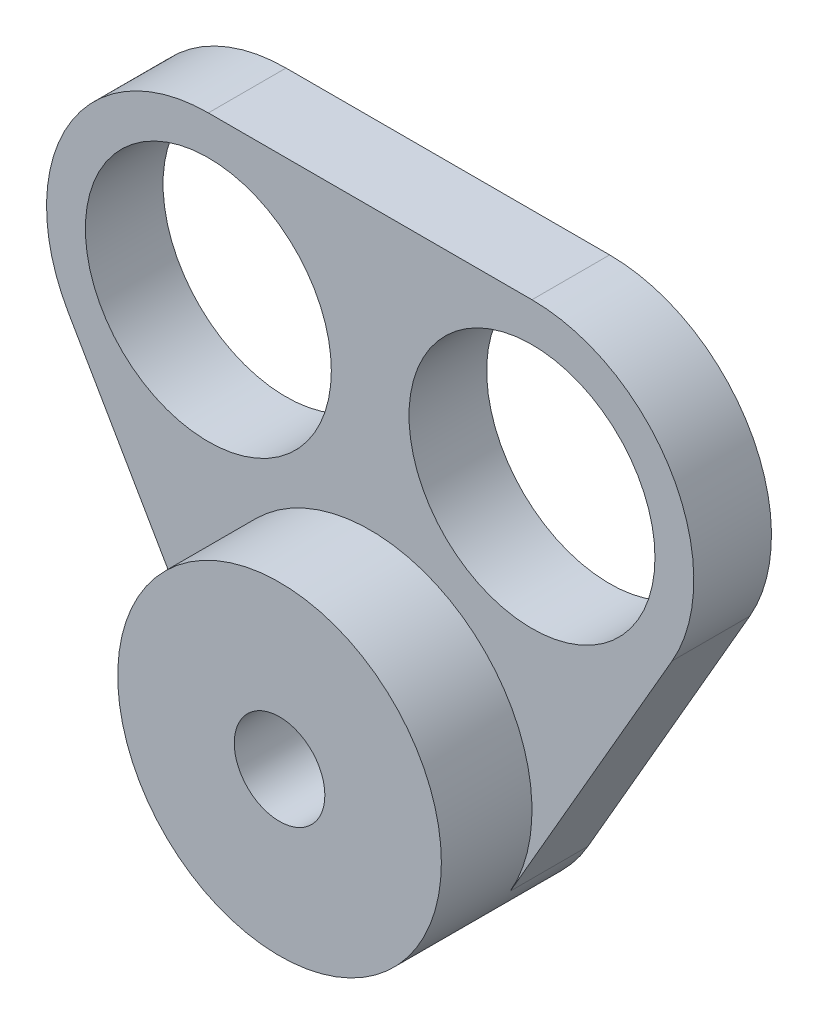
from build123d import *

# Parameters (mm, degrees)
CROQUIS1_R              = 9.5
SALIENTE_EXTRUIR1_DEPTH = 6
CROQUIS2_R              = 12.5
CROQUIS2_R_2            = 3.5
SALIENTE_EXTRUIR3_DEPTH = 7


with BuildPart() as part:
    # Croquis1 → Saliente-Extruir1 (new body)
    with BuildSketch(Plane.XY):
        with BuildLine():
            Line((-23.325317547, 15.400635095), (-10.825317547, -6.25))
            ThreePointArc((-10.825317547, -6.25), (0, -12.5), (10.825317547, -6.25))
            Line((10.825317547, -6.25), (23.325317547, 15.400635095))
            ThreePointArc((23.325317547, 15.400635095), (23.325317547, 27.900635095), (12.5, 34.150635095))
            Line((12.5, 34.150635095), (-12.5, 34.150635095))
            ThreePointArc((-12.5, 34.150635095), (-23.325317547, 27.900635095), (-23.325317547, 15.400635095))
        make_face()
        Circle(CROQUIS1_R, mode=Mode.SUBTRACT)
        with Locations((12.5, 21.650635095)):
            Circle(CROQUIS1_R, mode=Mode.SUBTRACT)
        with Locations((-12.5, 21.650635095)):
            Circle(CROQUIS1_R, mode=Mode.SUBTRACT)
    extrude(amount=SALIENTE_EXTRUIR1_DEPTH)

    # Croquis2 → Saliente-Extruir3 (add)
    with BuildSketch(Plane.XY.offset(6)):
        with Locations(Location((0, 0, 0), (0, 0, 210))):
            Circle(CROQUIS2_R)
        Circle(CROQUIS2_R_2, mode=Mode.SUBTRACT)
    extrude(amount=SALIENTE_EXTRUIR3_DEPTH)


solid = part.part
